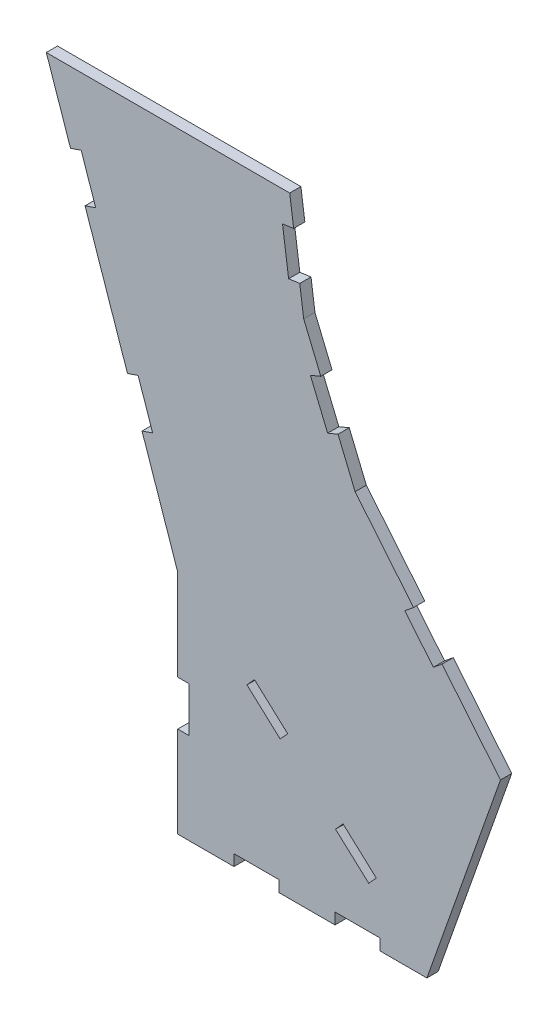
from build123d import *

# Parameters (mm, degrees)
P_IDAT_VYSUNUT_M1_DEPTH = 3


with BuildPart() as part:
    # Skica1 → Přidat vysunutím1 (new body)
    with BuildSketch(Plane.XY):
        Polygon((35.098999138, -102.619674243), (25.567500119, -74.752232196), (28.406057565, -73.781360615), (24.522571242, -62.427130832), (21.684013796, -63.398002412), (10.357178687, -30.281498877), (13.195736133, -29.310627296), (9.311034651, -17.952844725), (6.472477205, -18.923716306), (0, 0), (65, 0), (66.054709497, -7.67410463), (63.082647903, -8.082577246), (64.716538365, -19.970823625), (67.68859996, -19.562351009), (68.743309457, -27.236455639), (73.306691143, -38.242479423), (70.535456643, -39.391504813), (75.131558201, -50.476442813), (77.902792701, -49.327417423), (82.466174387, -60.333441207), (98.069771345, -79.328299093), (95.751633165, -81.232566768), (103.368703864, -90.505119489), (105.686842044, -88.600851814), (121.290439003, -107.5957097), (101.634461089, -163.225221043), (89.098999138, -163.225221043), (89.098999138, -160.225221043), (77.098999138, -160.225221043), (77.098999138, -163.225221043), (62.098999138, -163.225221043), (62.098999138, -160.225221043), (50.098999138, -160.225221043), (50.098999138, -163.225221043), (35.098999138, -163.225221043), (35.098999138, -138.920221043), (38.098999138, -138.920221043), (38.098999138, -126.920221043), (35.098999138, -126.920221043), align=None)
        Polygon((53.581071902, -119.454548354), (62.452466829, -127.535287927), (64.472651723, -125.317439195), (55.601256796, -117.236699622), align=None, mode=Mode.SUBTRACT)
        Polygon((77.238125041, -141.003187216), (86.109519967, -149.083926789), (88.129704861, -146.866078058), (79.258309934, -138.785338484), align=None, mode=Mode.SUBTRACT)
    extrude(amount=P_IDAT_VYSUNUT_M1_DEPTH)


solid = part.part
